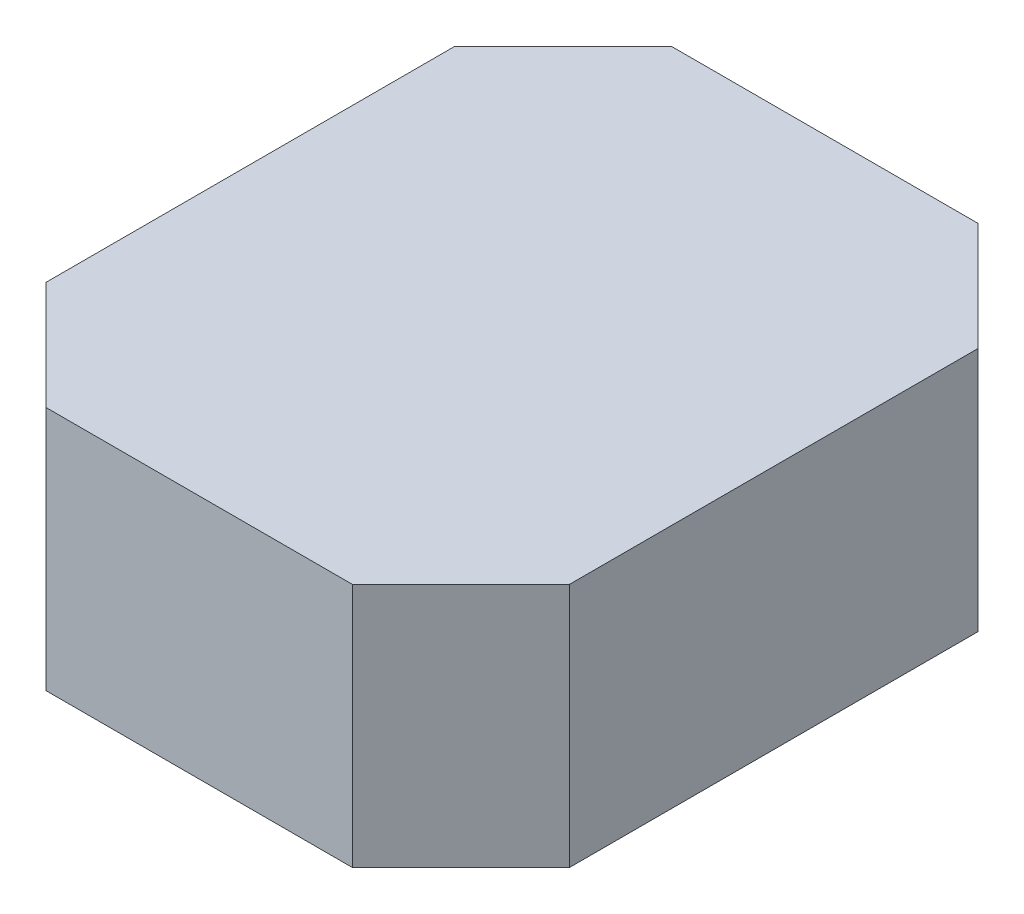
from build123d import *

# Parameters (mm, degrees)
BOSS_EXTRUDE1_DEPTH = 120


with BuildPart() as part:
    # Sketch1 → Boss-Extrude1 (new body)
    with BuildSketch(Plane(origin=(0, 0, 0), x_dir=(1, 0, 0), z_dir=(0, 1, 0))):
        Polygon((-128.033008589, 100), (-128.033008589, -100), (-75, -153.033008589), (75, -153.033008589), (128.033008589, -100), (128.033008589, 100), (75, 153.033008589), (-75, 153.033008589), align=None)
    extrude(amount=BOSS_EXTRUDE1_DEPTH)


solid = part.part
